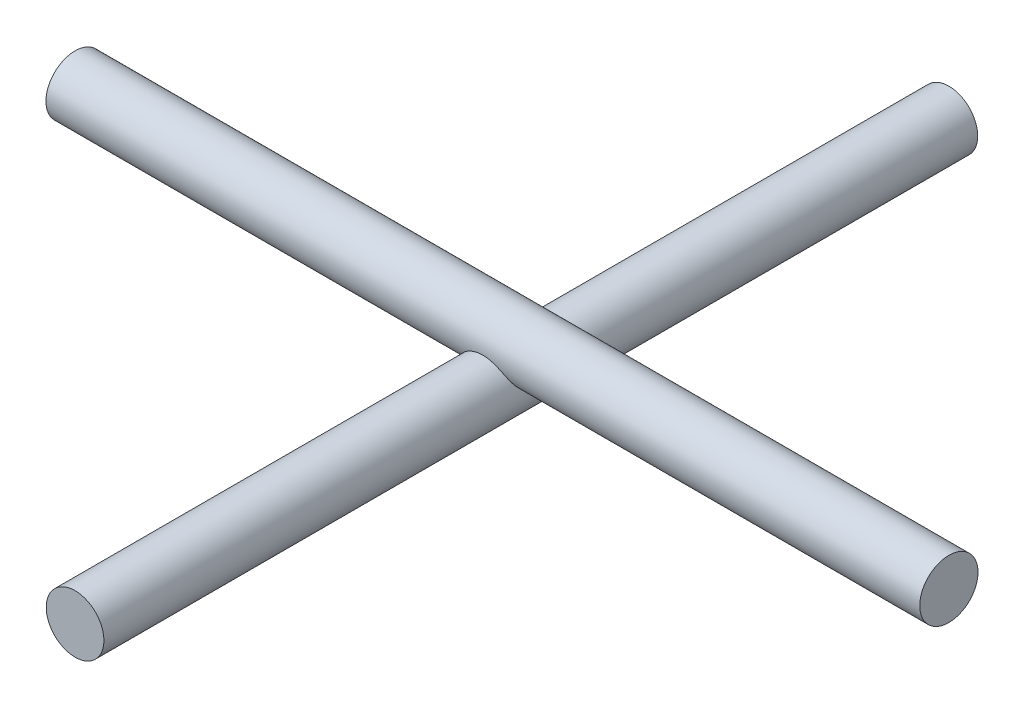
from build123d import *

# Parameters (mm, degrees)
BOSS_EXTRUDE1_DEPTH      = 37.5
BOSS_EXTRUDE1_DEPTH_BACK = 37.5
SKETCH2_R                = 2.475
BOSS_EXTRUDE2_DEPTH      = 37.5
BOSS_EXTRUDE2_DEPTH_BACK = 37.5
SKETCH3_R                = 2.5


with BuildPart() as part:
    # Sketch2 → Boss-Extrude1 (new, two sides: drawn at the far end of the back side and taken through both)
    with BuildSketch(Plane.XY.offset(-BOSS_EXTRUDE1_DEPTH_BACK)):
        Circle(SKETCH2_R)
    extrude(amount=BOSS_EXTRUDE1_DEPTH + BOSS_EXTRUDE1_DEPTH_BACK)

    # Sketch3 → Boss-Extrude2 (add, two sides: drawn at the far end of the back side and taken through both)
    with BuildSketch(Plane(origin=(0, 0, 0), x_dir=(0, 0, -1), z_dir=(1, 0, 0)).offset(-BOSS_EXTRUDE2_DEPTH_BACK)):
        with Locations((0, 2.6)):
            Circle(SKETCH3_R)
    extrude(amount=BOSS_EXTRUDE2_DEPTH + BOSS_EXTRUDE2_DEPTH_BACK)


solid = part.part
